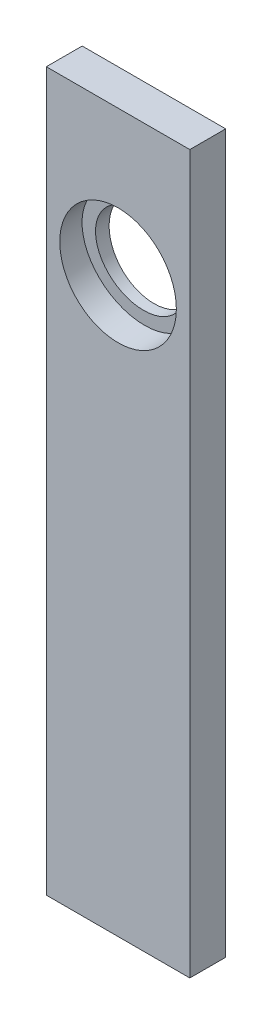
from build123d import *

# Parameters (mm, degrees)
SKETCH1_W           = 80
SKETCH1_H           = 400
BOSS_EXTRUDE1_DEPTH = 20
SKETCH4_R           = 32.5
CUT_EXTRUDE4_DEPTH  = 206.087962432
SKETCH6_R           = 25
CUT_EXTRUDE6_DEPTH  = 206.087962432


with BuildPart() as part:
    # Sketch1 → Boss-Extrude1 (new body)
    with BuildSketch(Plane.XY):
        Rectangle(SKETCH1_W, SKETCH1_H)
    extrude(amount=BOSS_EXTRUDE1_DEPTH)

    # Sketch4 → Cut-Extrude4 (cut, through all)
    with BuildSketch(Plane(origin=(0, 0.062016747, -0.8868808), x_dir=(1, 0, 0), z_dir=(0, -0.06975647374412192, 0.9975640502598245))):
        with Locations(Location((0, 120.405250769, 0), (0, 0, 90))):
            Circle(SKETCH4_R)
    extrude(amount=CUT_EXTRUDE4_DEPTH, mode=Mode.SUBTRACT)

    # Sketch6 → Cut-Extrude6 (cut, through all)
    with BuildSketch(Plane(origin=(0, 0.062016747, -0.8868808), x_dir=(1, 0, 0), z_dir=(0, -0.06975647374412192, 0.9975640502598246))):
        with Locations(Location((0, 120.405250769, 0), (0, 0, 270))):
            Circle(SKETCH6_R)
    extrude(amount=-CUT_EXTRUDE6_DEPTH, mode=Mode.SUBTRACT)


solid = part.part
